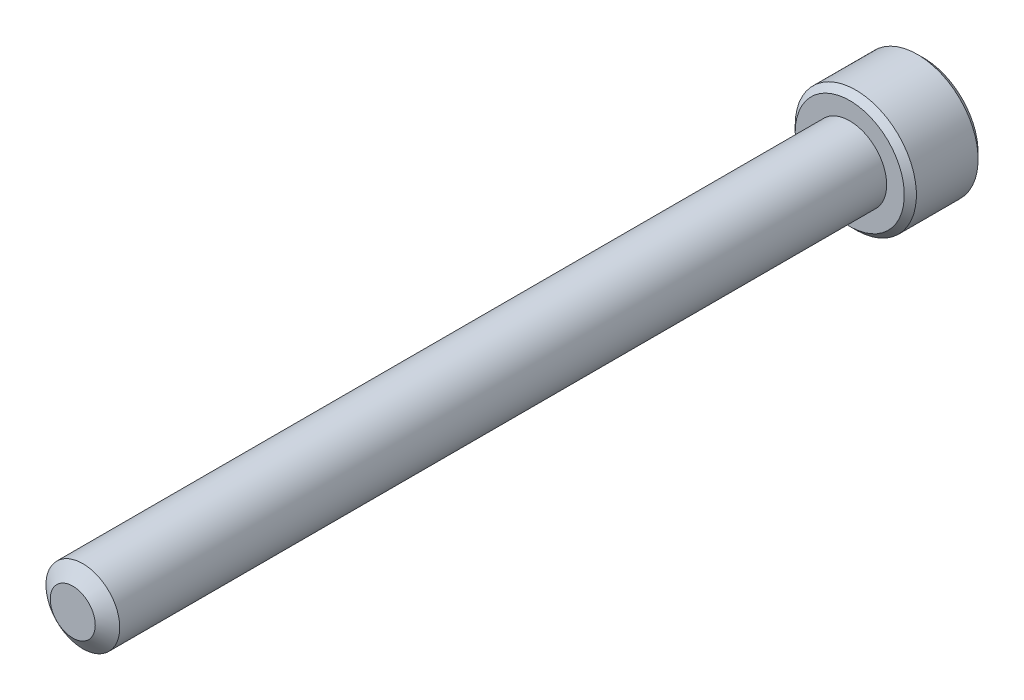
from build123d import *

# Parameters (mm, degrees)
SKETCH1_R          = 2.413
EXTRUDE1_DEPTH     = 50.8
SKETCH6_R          = 3.9624
EXTRUDE2_DEPTH     = 4.826
CUT_EXTRUDE1_DEPTH = 2.9765625
CHAMFER1_SIZE      = 0.39624


with BuildPart() as part:
    # Sketch1 → Extrude1 (new body)
    with BuildSketch(Plane.XY):
        Circle(SKETCH1_R)
    extrude(amount=-EXTRUDE1_DEPTH)

    # Sketch4 → Cut-Revolve1 (revolve, cut)
    with BuildSketch(Plane(origin=(0, 0, 0), x_dir=(0, 0, -1), z_dir=(1, 0, 0))):
        Polygon((0.659180743, 2.413), (0, 1.471592336), (0, 2.413), align=None)
    revolve(axis=Axis((0, 0, 0), (0, 0, -1)), mode=Mode.SUBTRACT)

    # Sketch6 → Extrude2 (add)
    with BuildSketch(Plane(origin=(0, 0, -50.8), x_dir=(-1, 0, 0), z_dir=(0, 0, -1))):
        Circle(SKETCH6_R)
    extrude(amount=EXTRUDE2_DEPTH)

    # Sketch7 → Cut-Extrude1 (cut)
    with BuildSketch(Plane(origin=(0, 0, -55.626), x_dir=(-1, 0, 0), z_dir=(0, 0, -1))):
        Polygon((0, 2.291358881), (-1.984375, 1.14567944), (-1.984375, -1.14567944), (0, -2.291358881), (1.984375, -1.14567944), (1.984375, 1.14567944), align=None)
    extrude(amount=-CUT_EXTRUDE1_DEPTH, mode=Mode.SUBTRACT)

    # Cut-Extrude2 cone 1 section (through the dimple's axis) → Cut-Extrude2 (revolve, cut)
    with BuildSketch(Plane(origin=(0, 0, -55.626), x_dir=(0, 1, 0), z_dir=(1, 0, 0))):
        Polygon((0, 0), (2.291358881, 0), (0, 2.291358881), align=None)
    revolve(axis=Axis((0, 0, -55.626), (0, 0, 1)), mode=Mode.SUBTRACT)

    # Chamfer1
    chamfer1_edges = [part.edges().sort_by_distance(p)[0] for p in [
        (3.9624, 0, -55.626),
        (3.9624, 0, -50.8),
    ]]
    chamfer(chamfer1_edges, length=CHAMFER1_SIZE)


solid = part.part
